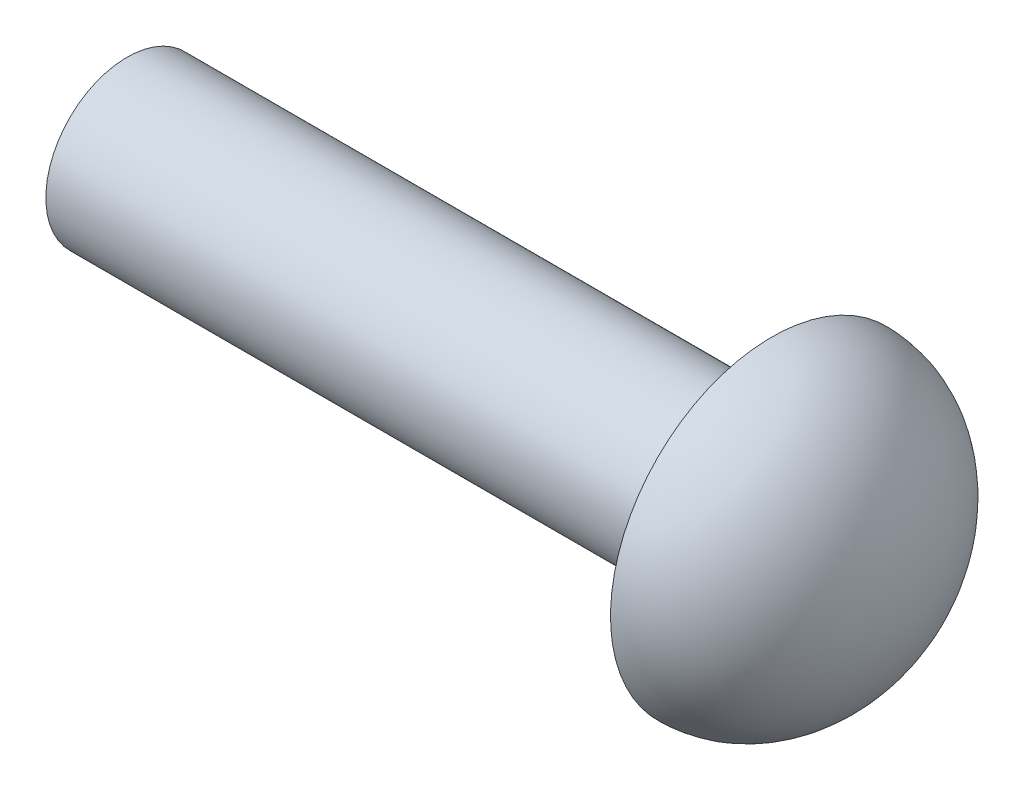
from build123d import *


with BuildPart() as part:
    # Sketch1 → Revolve1 (revolve)
    with BuildSketch(Plane.XY, mode=Mode.PRIVATE) as revolve1_sk:
        with BuildLine():
            Line((0, 0), (0, -1.260330579))
            Line((0, -1.260330579), (10, -1.260330579))
            Line((10, -1.260330579), (10, -2.5))
            add(Edge.make_bspline(
                [(10, -2.5), (12, -2.5), (12, 0)],
                knots=[3.141592654, 3.141592654, 3.141592654, 4.71238898, 4.71238898, 4.71238898], degree=2, weights=[1, 0.707106781, 1]))
            Line((12, 0), (0, 0))
        make_face()
    revolve(revolve1_sk.sketch.rotate(Axis((12, 0, 0), (-1, 0, 0)), 270), axis=Axis((12, 0, 0), (-1, 0, 0)))


solid = part.part
